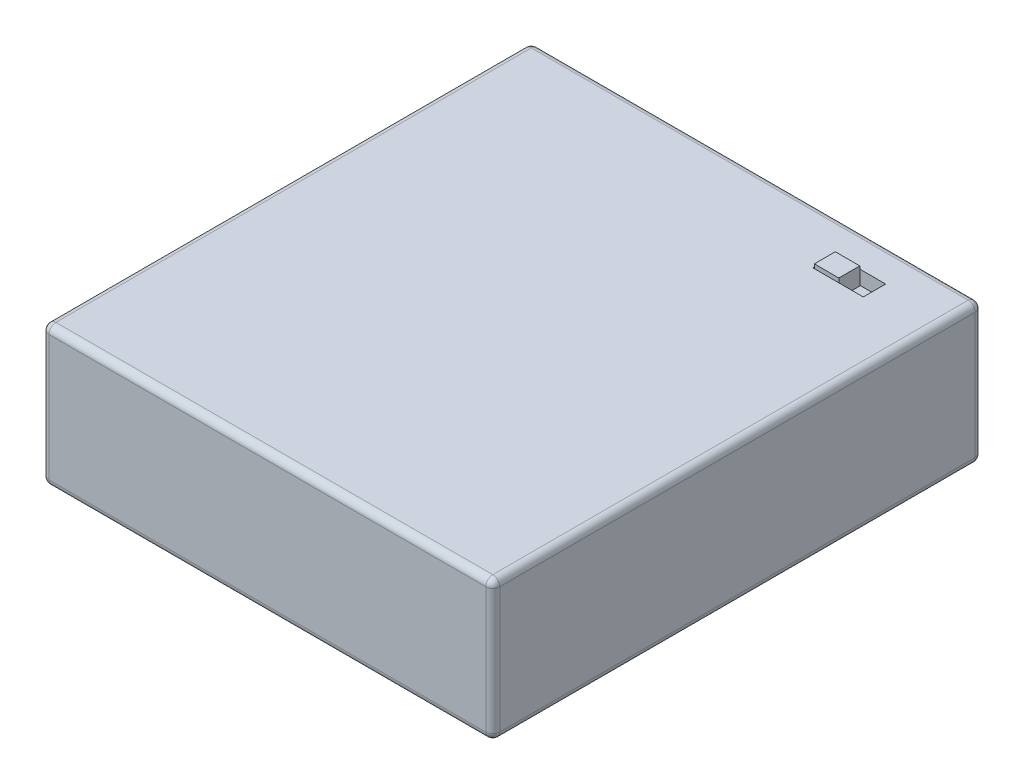
from build123d import *

# Parameters (mm, degrees)
SKETCH_1_W          = 64.5
SKETCH_1_H          = 70
EXTRUDE_1_DEPTH     = 20
FILLET_1_R          = 1
CUT_EXTRUDE_START   = 20
SKETCH_1_9_W        = 7.2
SKETCH_1_9_H        = 3.2
CUT_EXTRUDE_1_DEPTH = 2
EXTRUDE_START       = 18
SKETCH_1_10_W       = 3.5
SKETCH_1_10_H       = 3
EXTRUDE_2_DEPTH     = 2.5
SKETCH_2_R          = 2.5
CUT_EXTRUDE_2_DEPTH = 2


with BuildPart() as part:
    # 草图1 → 凸台-拉伸1 (new body)
    with BuildSketch(Plane(origin=(0, 0, 0), x_dir=(1, 0, 0), z_dir=(0, 1, 0))):
        Rectangle(SKETCH_1_W, SKETCH_1_H)
    extrude(amount=EXTRUDE_1_DEPTH)

    # 圆角1
    fillet_1_edges = [part.edges().sort_by_distance(p)[0] for p in [
        (0, 20, -35),
        (-32.25, 20, 0),
        (0, 20, 35),
        (-32.25, 0, 0),
        (0, 0, -35),
        (32.25, 0, 0),
        (0, 0, 35),
        (-32.25, 10, 35),
        (-32.25, 10, -35),
        (32.25, 10, -35),
        (32.25, 10, 35),
        (32.25, 20, 0),
    ]]
    fillet(fillet_1_edges, radius=FILLET_1_R)

    # 草图1<9> → 切除-拉伸1 (cut)
    with BuildSketch(Plane(origin=(0, 0, 0), x_dir=(1, 0, 0), z_dir=(0, 1, 0)).offset(CUT_EXTRUDE_START)):
        with Locations((19.75, 28.5)):
            Rectangle(SKETCH_1_9_W, SKETCH_1_9_H)
    extrude(amount=-CUT_EXTRUDE_1_DEPTH, mode=Mode.SUBTRACT)

    # 草图1<10> → 凸台-拉伸2 (add)
    with BuildSketch(Plane(origin=(0, 0, 0), x_dir=(1, 0, 0), z_dir=(0, 1, 0)).offset(EXTRUDE_START)):
        with Locations((18, 28.5)):
            Rectangle(SKETCH_1_10_W, SKETCH_1_10_H)
    extrude(amount=EXTRUDE_2_DEPTH)

    # 草图2 → 切除-拉伸2 (cut)
    with BuildSketch(Plane(origin=(0, 0, -35), x_dir=(-1, 0, 0), z_dir=(0, 0, -1))):
        with Locations((25.25, 15)):
            Circle(SKETCH_2_R)
    extrude(amount=-CUT_EXTRUDE_2_DEPTH, mode=Mode.SUBTRACT)


solid = part.part
